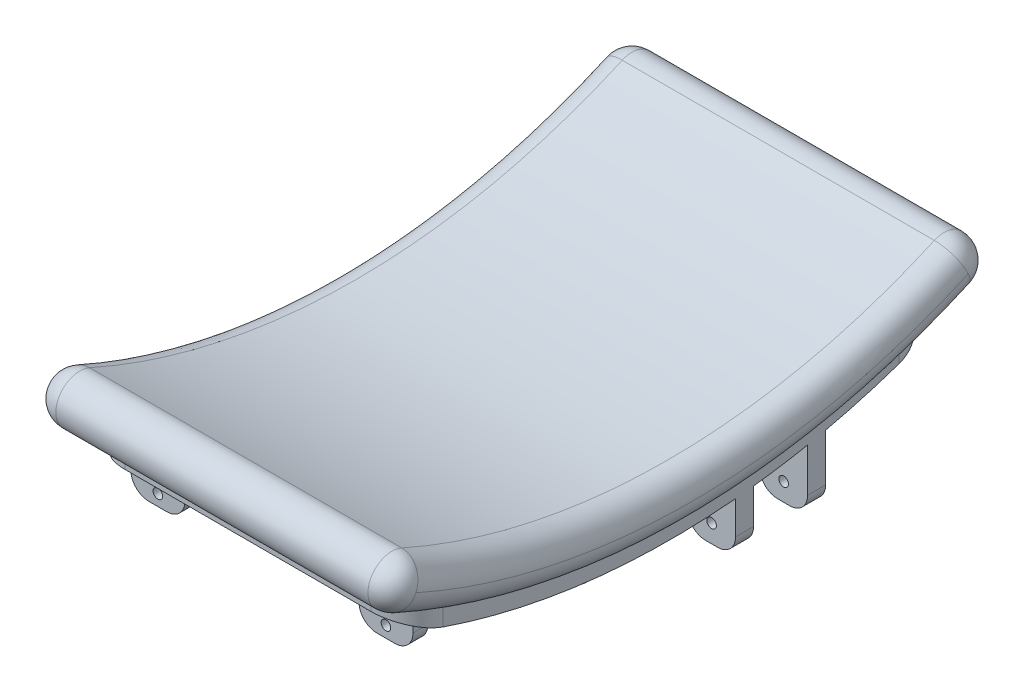
from build123d import *

# Parameters (mm, degrees)
BOSS_EXTRUDE1_DEPTH     = 150
FILLET1_R               = 20
BOSS_EXTRUDE2_DEPTH     = 132.5
FILLET2_R               = 30
BOSS_EXTRUDE3_REACH     = 311.991
SKETCH3_W               = 45
SKETCH3_H               = 40
SKETCH5_W               = 44.999999999999986
SKETCH5_H               = 15.000000000000028
CUT_EXTRUDE1_DEPTH      = 30
FILLET3_R               = 15
SKETCH6_R               = 4.000000000000007
CUT_EXTRUDE2_DEPTH      = 44.000000000000014
BOSS_EXTRUDE4_REACH     = 327.762
SKETCH8_R               = 3.0000000000000084
CUT_EXTRUDE3_DEPTH      = 620.0365498336911
MIRROR4_COPY_1_SKETCH_W = 44.999999999999986
MIRROR4_COPY_1_SKETCH_H = 15.000000000000028
MIRROR4_COPY_1_DEPTH    = 30
MIRROR4_COPY_2_SKETCH_R = 4.000000000000007
MIRROR4_COPY_2_DEPTH    = 44.000000000000014
FILLET3_OF_MIRROR4_R    = 15
BOSS_EXTRUDE5_REACH     = 327.762
SKETCH9_W               = 40
SKETCH9_H               = 15.000000000000014
FILLET4_R               = 15
SKETCH10_R              = 4.000000000000007
CUT_EXTRUDE4_DEPTH      = 130


with BuildPart() as part:
    # Sketch1 → Boss-Extrude1 (new, symmetric)
    with BuildSketch(Plane(origin=(0, 0, 0), x_dir=(0, 0, -1), z_dir=(1, 0, 0))):
        with BuildLine():
            ThreePointArc((-238.1705150976909, -422.9251079306098), (3.57e-14, -473.79372778271767), (238.1705150976909, -422.9251079306098))
            ThreePointArc((238.1705150976909, -422.9251079306098), (248.25493585412997, -396.499656978789), (221.82948490230902, -386.4152362223495))
            ThreePointArc((221.82948490230902, -386.4152362223495), (3.325e-14, -433.79372778271744), (-221.82948490230902, -386.4152362223495))
            ThreePointArc((-221.82948490230902, -386.4152362223495), (-248.2549358541303, -396.49965697878883), (-238.1705150976909, -422.9251079306098))
        make_face()
    extrude(amount=BOSS_EXTRUDE1_DEPTH, both=True)

    # Fillet1
    fillet1_edges = [part.edges().sort_by_distance(p)[0] for p in [
        (-150, -396.49965697878883, -248.25493585412988),
        (-150, -473.7937277827177, 2.842e-14),
        (-150, -396.49965697878866, 248.25493585413022),
        (150, -396.49965697878883, -248.25493585412988),
        (150, -473.7937277827177, 2.842e-14),
        (150, -396.49965697878866, 248.25493585413022),
        (-150, -433.79372778271744, -7.11e-15),
        (150, -433.79372778271744, -7.11e-15),
    ]]
    fillet(fillet1_edges, radius=FILLET1_R)


with BuildPart() as body_2:
    # Sketch2 → Boss-Extrude2 (new, symmetric)
    with BuildSketch(Plane(origin=(0, 0, 0), x_dir=(0, 0, -1), z_dir=(1, 0, 0))):
        with BuildLine():
            Line((-220, -430.6909402222708), (-220, -446.91247495884767))
            ThreePointArc((-220, -446.91247495884767), (8.09e-15, -489.8219434542895), (220, -446.91247495884767))
            Line((220, -446.91247495884767), (220, -430.6909402222708))
            ThreePointArc((220, -430.6909402222708), (7.17e-15, -474.8219434542895), (-220, -430.6909402222708))
        make_face()
    extrude(amount=BOSS_EXTRUDE2_DEPTH, both=True)

    # Fillet2
    fillet2_edges = [body_2.edges().sort_by_distance(p)[0] for p in [
        (132.5, -438.8017075905592, -220),
        (-132.5, -438.8017075905592, -220),
        (-132.5, -438.8017075905592, 220),
        (132.5, -438.8017075905592, 220),
    ]]
    fillet(fillet2_edges, radius=FILLET2_R)

    # Sketch3 → Boss-Extrude3 (add, up to next)
    with BuildSketch(Plane(origin=(0, -490, 0), x_dir=(1, 0, 0), z_dir=(0, 1, 0)), mode=Mode.PRIVATE) as boss_extrude3_sk1:
        Polygon((62.49999999999997, -190.00000000000003), (107.49999999999997, -190.00000000000003), (107.49999999999996, -150.00000000000003), (62.49999999999996, -150.00000000000003), align=None)
    boss_extrude3_tool1 = extrude(boss_extrude3_sk1.sketch, amount=BOSS_EXTRUDE3_REACH, mode=Mode.PRIVATE) - body_2.part
    # Sketch3 → Boss-Extrude3 (add, up to next)
    with BuildSketch(Plane(origin=(0, -490, 0), x_dir=(1, 0, 0), z_dir=(0, 1, 0)), mode=Mode.PRIVATE) as boss_extrude3_sk2:
        with Locations((85.00000000000009, 170)):
            Rectangle(SKETCH3_W, SKETCH3_H)
    boss_extrude3_tool2 = extrude(boss_extrude3_sk2.sketch, amount=BOSS_EXTRUDE3_REACH, mode=Mode.PRIVATE) - body_2.part
    boss_extrude3_1 = boss_extrude3_tool1.solids().sort_by_distance((85, -490, 170))[0]
    add(boss_extrude3_1)
    boss_extrude3_2 = boss_extrude3_tool2.solids().sort_by_distance((85, -490, -170))[0]
    add(boss_extrude3_2)
    boss_extrude3 = boss_extrude3_1 + boss_extrude3_2  # Boss-Extrude3 as one shape, for the pattern or mirror that repeats it

    # Sketch5 → Cut-Extrude1 (cut)
    with BuildSketch(Plane.XZ.offset(490)):
        with Locations((85.00000000000009, -170)):
            Rectangle(SKETCH5_W, SKETCH5_H)
    cut_extrude1 = extrude(amount=-CUT_EXTRUDE1_DEPTH, mode=Mode.SUBTRACT)

    # Mirror1: Cut-Extrude1 across plane
    add(cut_extrude1.mirror(Plane.XY), mode=Mode.SUBTRACT)

    # Fillet3
    fillet3_edges = [body_2.edges().sort_by_distance(p)[0] for p in [
        (62.49999999999996, -490, 156.25),
        (62.49999999999997, -490, 183.75000000000003),
        (107.49999999999997, -490, 183.75000000000003),
        (107.49999999999996, -490, 156.25),
        (62.500000000000085, -490, -156.25),
        (107.50000000000009, -490, -156.25),
        (62.500000000000085, -490, -183.75),
        (107.50000000000009, -490, -183.75),
    ]]
    fillet(fillet3_edges, radius=FILLET3_R)

    # Sketch6 → Cut-Extrude2 (cut)
    with BuildSketch(Plane.XY.offset(190.00000000000003)):
        with Locations((85.00000000000007, -480.632373414827)):
            Circle(SKETCH6_R)
    cut_extrude2 = extrude(amount=-CUT_EXTRUDE2_DEPTH, mode=Mode.SUBTRACT)

    # Mirror2: Cut-Extrude2 across plane
    add(cut_extrude2.mirror(Plane.XY), mode=Mode.SUBTRACT)

    # Sketch7 → Boss-Extrude4 (add, up to next)
    with BuildSketch(Plane(origin=(0, -530, 0), x_dir=(1, 0, 0), z_dir=(0, 1, 0)), mode=Mode.PRIVATE) as boss_extrude4_sk1:
        Polygon((98.74999999999999, -17.5), (98.74999999999999, -32.499999999999986), (33.74999999999999, -32.5), (33.74999999999999, -17.5), align=None)
    boss_extrude4_tool1 = extrude(boss_extrude4_sk1.sketch, amount=BOSS_EXTRUDE4_REACH, mode=Mode.PRIVATE) - body_2.part
    # Sketch7 → Boss-Extrude4 (add, up to next)
    with BuildSketch(Plane(origin=(0, -530, 0), x_dir=(1, 0, 0), z_dir=(0, 1, 0)), mode=Mode.PRIVATE) as boss_extrude4_sk2:
        Polygon((98.74999999999999, 32.500000000000014), (33.749999999999986, 32.50000000000001), (33.74999999999999, 17.5), (98.74999999999999, 17.5), align=None)
    boss_extrude4_tool2 = extrude(boss_extrude4_sk2.sketch, amount=BOSS_EXTRUDE4_REACH, mode=Mode.PRIVATE) - body_2.part
    add(boss_extrude4_tool1.solids().sort_by_distance((66.25, -530, 25))[0])
    add(boss_extrude4_tool2.solids().sort_by_distance((66.25, -530, -25))[0])

    # Sketch8 → Cut-Extrude3 (cut, through all)
    with BuildSketch(Plane.XY.offset(32.50000000000001)):
        with Locations((80.5397453163993, -511.6033921234513)):
            Circle(SKETCH8_R)
        with BuildLine():
            Line((67.26255540401009, -524.2111376342729), (33.74999999999999, -488.9191370012814))
            Line((33.74999999999999, -488.9191370012814), (33.749999999999986, -530))
            Line((33.749999999999986, -530), (98.74999999999997, -530))
            Line((98.74999999999997, -530), (98.74999999999997, -513.5075043033636))
            ThreePointArc((98.74999999999997, -513.5075043033636), (86.43259892308934, -528.9387114226569), (67.26255540401009, -524.2111376342729))
        make_face()
    extrude(amount=-CUT_EXTRUDE3_DEPTH, mode=Mode.SUBTRACT)

    # Mirror4: Boss-Extrude3, Cut-Extrude1, Cut-Extrude2 across plane
    add(boss_extrude3.mirror(Plane(origin=(-10, 0, 0), x_dir=(0, 0, 1), z_dir=(1, 0, 0))))
    add(cut_extrude1.mirror(Plane(origin=(-10, 0, 0), x_dir=(0, 0, 1), z_dir=(1, 0, 0))), mode=Mode.SUBTRACT)
    add(cut_extrude2.mirror(Plane(origin=(-10, 0, 0), x_dir=(0, 0, 1), z_dir=(1, 0, 0))), mode=Mode.SUBTRACT)

    # Mirror4 copy 1 sketch → Mirror4 copy 1 (cut)
    with BuildSketch(Plane(origin=(-20, -490, 0), x_dir=(-1, 0, 0), z_dir=(0, -1, 0))):
        with Locations((85.00000000000009, -170)):
            Rectangle(MIRROR4_COPY_1_SKETCH_W, MIRROR4_COPY_1_SKETCH_H)
    extrude(amount=-MIRROR4_COPY_1_DEPTH, mode=Mode.SUBTRACT)

    # Mirror4 copy 2 sketch → Mirror4 copy 2 (cut)
    with BuildSketch(Plane(origin=(-20, 0, -190.00000000000003), x_dir=(-1, 0, 0), z_dir=(0, 0, -1))):
        with Locations((85.00000000000007, -480.632373414827)):
            Circle(MIRROR4_COPY_2_SKETCH_R)
    extrude(amount=-MIRROR4_COPY_2_DEPTH, mode=Mode.SUBTRACT)

    # Fillet3 of Mirror4
    fillet3_of_mirror4_edges = [body_2.edges().sort_by_distance(p)[0] for p in [
        (-82.49999999999996, -490, 156.25),
        (-82.49999999999997, -490, 183.75000000000003),
        (-127.49999999999997, -490, 183.75000000000003),
        (-127.49999999999996, -490, 156.25),
        (-82.50000000000009, -490, -156.25),
        (-127.50000000000009, -490, -156.25),
        (-82.50000000000009, -490, -183.75),
        (-127.50000000000009, -490, -183.75),
    ]]
    fillet(fillet3_of_mirror4_edges, radius=FILLET3_OF_MIRROR4_R)

    # Sketch9 → Boss-Extrude5 (add, up to next)
    with BuildSketch(Plane(origin=(0, -530, 0), x_dir=(1, 0, 0), z_dir=(0, 1, 0)), mode=Mode.PRIVATE) as boss_extrude5_sk1:
        with Locations((112.5, 121.25000000000003)):
            Rectangle(SKETCH9_W, SKETCH9_H)
    boss_extrude5_tool1 = extrude(boss_extrude5_sk1.sketch, amount=BOSS_EXTRUDE5_REACH, mode=Mode.PRIVATE) - body_2.part
    # Sketch9 → Boss-Extrude5 (add, up to next)
    with BuildSketch(Plane(origin=(0, -530, 0), x_dir=(1, 0, 0), z_dir=(0, 1, 0)), mode=Mode.PRIVATE) as boss_extrude5_sk2:
        Polygon((92.5, 68.75000000000001), (132.5, 68.75000000000001), (132.5, 53.75000000000002), (92.49999999999999, 53.75000000000002), align=None)
    boss_extrude5_tool2 = extrude(boss_extrude5_sk2.sketch, amount=BOSS_EXTRUDE5_REACH, mode=Mode.PRIVATE) - body_2.part
    add(boss_extrude5_tool1.solids().sort_by_distance((112.5, -530, -121.25))[0])
    add(boss_extrude5_tool2.solids().sort_by_distance((112.5, -530, -61.25))[0])

    # Fillet4
    fillet4_edges = [body_2.edges().sort_by_distance(p)[0] for p in [
        (132.5, -530, -61.250000000000014),
        (92.49999999999999, -530, -61.250000000000014),
        (92.5, -530, -121.25000000000003),
        (132.5, -530, -121.25000000000003),
    ]]
    fillet(fillet4_edges, radius=FILLET4_R)

    # Sketch10 → Cut-Extrude4 (cut)
    with BuildSketch(Plane(origin=(0, 0, -128.75000000000003), x_dir=(-1, 0, 0), z_dir=(0, 0, -1))):
        with Locations((-112.5, -515)):
            Circle(SKETCH10_R)
    extrude(amount=-CUT_EXTRUDE4_DEPTH, mode=Mode.SUBTRACT)


solid = Compound([part.part, body_2.part])
